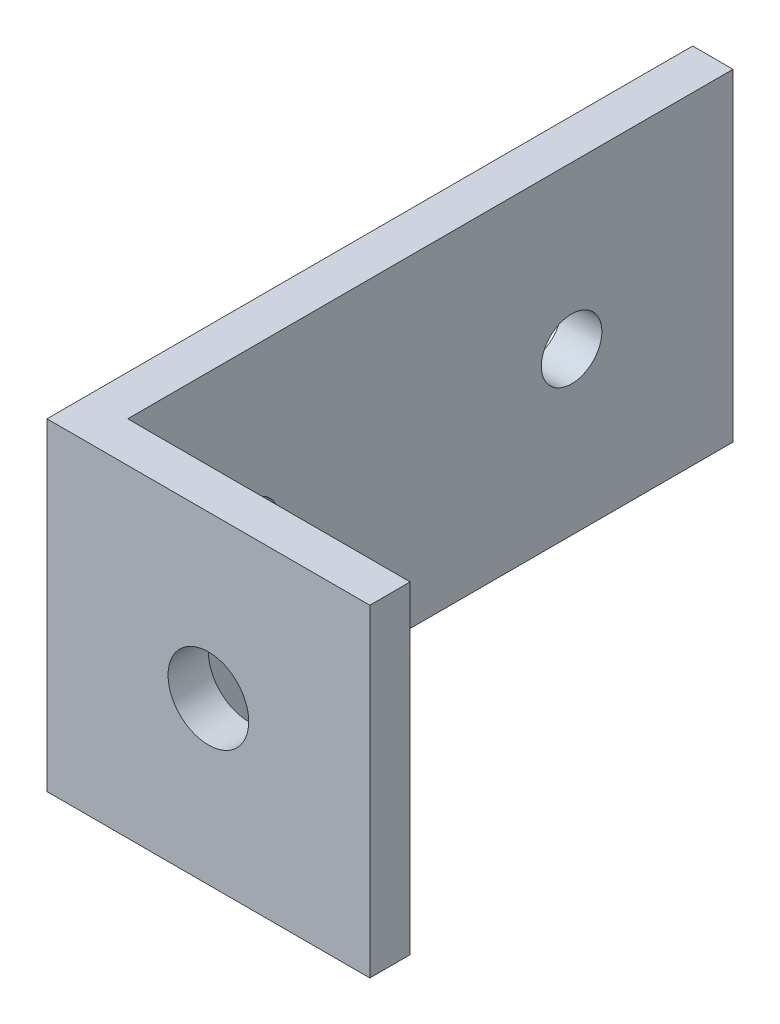
from build123d import *

# Parameters (mm, degrees)
BOSS_EXTRUDE1_DEPTH = 25.4
SKETCH2_R           = 3.175
CUT_EXTRUDE1_DEPTH  = 59.371664787
SKETCH3_R           = 2.38125
CUT_EXTRUDE2_DEPTH  = 60.652834174


with BuildPart() as part:
    # Sketch1 → Boss-Extrude1 (new body)
    with BuildSketch(Plane(origin=(0, 0, 0), x_dir=(1, 0, 0), z_dir=(0, 1, 0))):
        Polygon((-3.175, 47.625), (0, 47.625), (0, 0), (22.225, 0), (22.225, -3.175), (4.259627329, -3.175), (-3.175, -3.175), align=None)
    extrude(amount=BOSS_EXTRUDE1_DEPTH)

    # Sketch2 → Cut-Extrude1 (cut, through all)
    with BuildSketch(Plane(origin=(0, 0, 0), x_dir=(-1, 0, 0), z_dir=(0, 0, -1))):
        with Locations((-9.525, 12.7)):
            Circle(SKETCH2_R)
    extrude(amount=-CUT_EXTRUDE1_DEPTH, mode=Mode.SUBTRACT)

    # Sketch3 → Cut-Extrude2 (cut, through all)
    with BuildSketch(Plane.ZY.offset(3.175)):
        with Locations((-9.525, 12.7)):
            Circle(SKETCH3_R)
        with Locations((-34.925, 12.7)):
            Circle(SKETCH3_R)
    extrude(amount=-CUT_EXTRUDE2_DEPTH, mode=Mode.SUBTRACT)


solid = part.part
